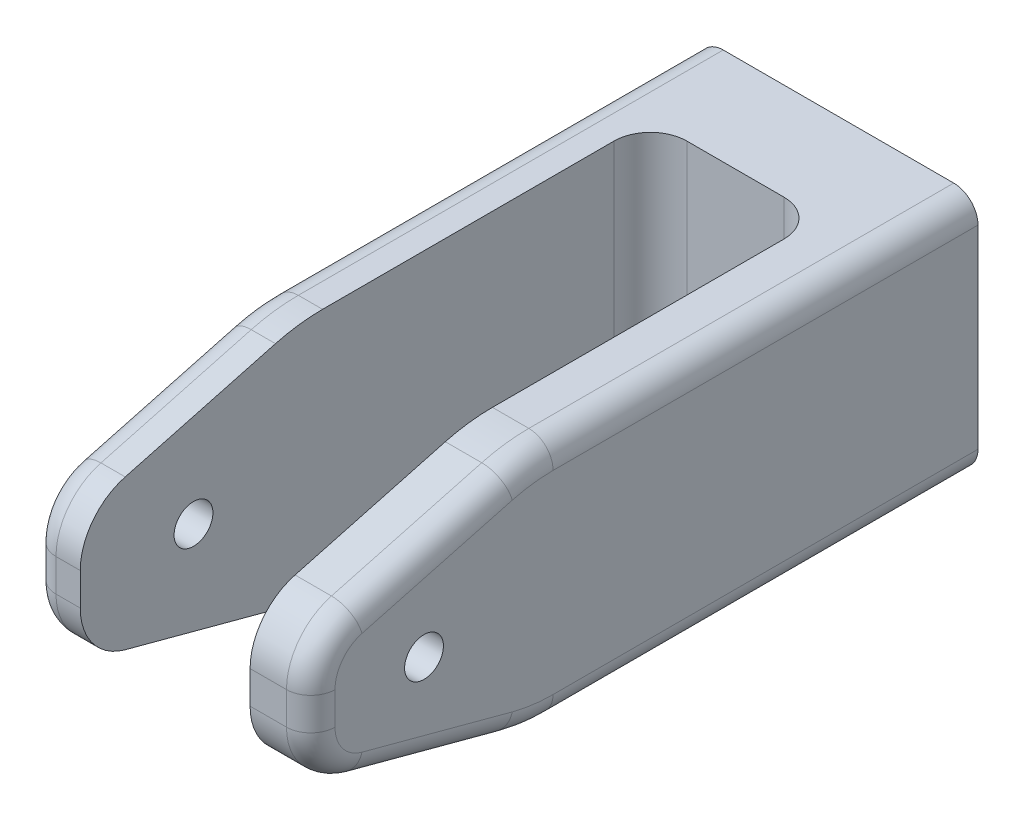
from build123d import *

# Parameters (mm, degrees)
SKETCH1_R           = 1.6
BOSS_EXTRUDE1_DEPTH = 2.5
SKETCH2_R           = 1.6
BOSS_EXTRUDE2_DEPTH = 4
SKETCH3_W           = 23
SKETCH3_H           = 20
BOSS_EXTRUDE3_DEPTH = 8
FILLET1_R           = 3
FILLET2_R           = 15
FILLET3_R           = 2


with BuildPart() as part:
    # Sketch1 → Boss-Extrude1 (new, symmetric)
    with BuildSketch(Plane.ZY.offset(1089.950719415)):
        with BuildLine():
            Line((82.004058992, 86.47718844), (82.004058992, 83.796629248))
            ThreePointArc((82.004058992, 83.796629248), (80.970825694, 80.752822103), (78.298154218, 78.967000116))
            Line((78.298154218, 78.967000116), (64.004058992, 75.136908844))
            Line((64.004058992, 75.136908844), (27.004058992, 75.136908844))
            Line((27.004058992, 75.136908844), (27.004058992, 95.136908844))
            Line((27.004058992, 95.136908844), (64.004058992, 95.136908844))
            Line((64.004058992, 95.136908844), (78.298154218, 91.306817572))
            ThreePointArc((78.298154218, 91.306817572), (80.970825694, 89.520995585), (82.004058992, 86.47718844))
        make_face()
        with Locations((72.667931354, 85.136908844)):
            Circle(SKETCH1_R, mode=Mode.SUBTRACT)
    extrude(amount=BOSS_EXTRUDE1_DEPTH, both=True)



with BuildPart() as body_2:
    # Sketch2 → Boss-Extrude2 (new body)
    with BuildSketch(Plane.ZY.offset(1106.450719415)):
        with BuildLine():
            Line((27.004058992, 95.136908844), (27.004058992, 75.136908844))
            Line((27.004058992, 75.136908844), (64.004058992, 75.136908844))
            Line((64.004058992, 75.136908844), (78.298154218, 78.967000116))
            ThreePointArc((78.298154218, 78.967000116), (80.970825694, 80.752822103), (82.004058992, 83.796629248))
            Line((82.004058992, 83.796629248), (82.004058992, 86.47718844))
            ThreePointArc((82.004058992, 86.47718844), (80.970825694, 89.520995585), (78.298154218, 91.306817572))
            Line((78.298154218, 91.306817572), (64.004058992, 95.136908844))
            Line((64.004058992, 95.136908844), (27.004058992, 95.136908844))
        make_face()
        with Locations((72.667931354, 85.136908844)):
            Circle(SKETCH2_R, mode=Mode.SUBTRACT)
    extrude(amount=BOSS_EXTRUDE2_DEPTH)


with BuildPart() as part_1:
    add(part.part)

    add(body_2.part)  # Boss-Extrude3 merges body 2
    # Sketch3 → Boss-Extrude3 (add)
    with BuildSketch(Plane(origin=(0, 0, 27.004058992), x_dir=(-1, 0, 0), z_dir=(0, 0, -1))):
        with Locations((1098.950719415, 85.136908844)):
            Rectangle(SKETCH3_W, SKETCH3_H)
    extrude(amount=-BOSS_EXTRUDE3_DEPTH)

    # Fillet1
    fillet1_edges = [part_1.edges().sort_by_distance(p)[0] for p in [
        (-1092.450719415, 85.136908844, 35.004058992),
        (-1106.450719415, 85.136908844, 35.004058992),
    ]]
    fillet(fillet1_edges, radius=FILLET1_R)

    # Fillet2
    fillet2_edges = [part_1.edges().sort_by_distance(p)[0] for p in [
        (-1089.950719415, 95.136908844, 64.004058992),
        (-1089.950719415, 75.136908844, 64.004058992),
        (-1108.450719415, 95.136908844, 64.004058992),
        (-1108.450719415, 75.136908844, 64.004058992),
    ]]
    fillet(fillet2_edges, radius=FILLET2_R)

    # Fillet3
    fillet3_edges = [part_1.edges().sort_by_distance(p)[0] for p in [
        (-1087.450719415, 80.752822103, 80.970825694),
        (-1087.450719415, 75.136908844, 44.51666526),
        (-1110.450719415, 80.752822103, 80.970825694),
        (-1110.450719415, 85.136908844, 82.004058992),
        (-1110.450719415, 89.520995585, 80.970825694),
        (-1110.450719415, 92.966306905, 72.104855711),
        (-1110.450719415, 95.136908844, 44.51666526),
        (-1087.450719415, 95.136908844, 44.51666526),
        (-1087.450719415, 92.966306905, 72.104855711),
        (-1110.450719415, 75.136908844, 44.51666526),
        (-1087.450719415, 89.520995585, 80.970825694),
        (-1110.450719415, 77.307510783, 72.104855711),
        (-1110.450719415, 75.265235923, 63.987164412),
        (-1110.450719415, 95.008581765, 63.987164412),
        (-1087.450719415, 77.307510783, 72.104855711),
        (-1087.450719415, 75.265235923, 63.987164412),
        (-1087.450719415, 95.008581765, 63.987164412),
        (-1087.450719415, 85.136908844, 82.004058992),
    ]]
    fillet(fillet3_edges, radius=FILLET3_R)


solid = part_1.part
